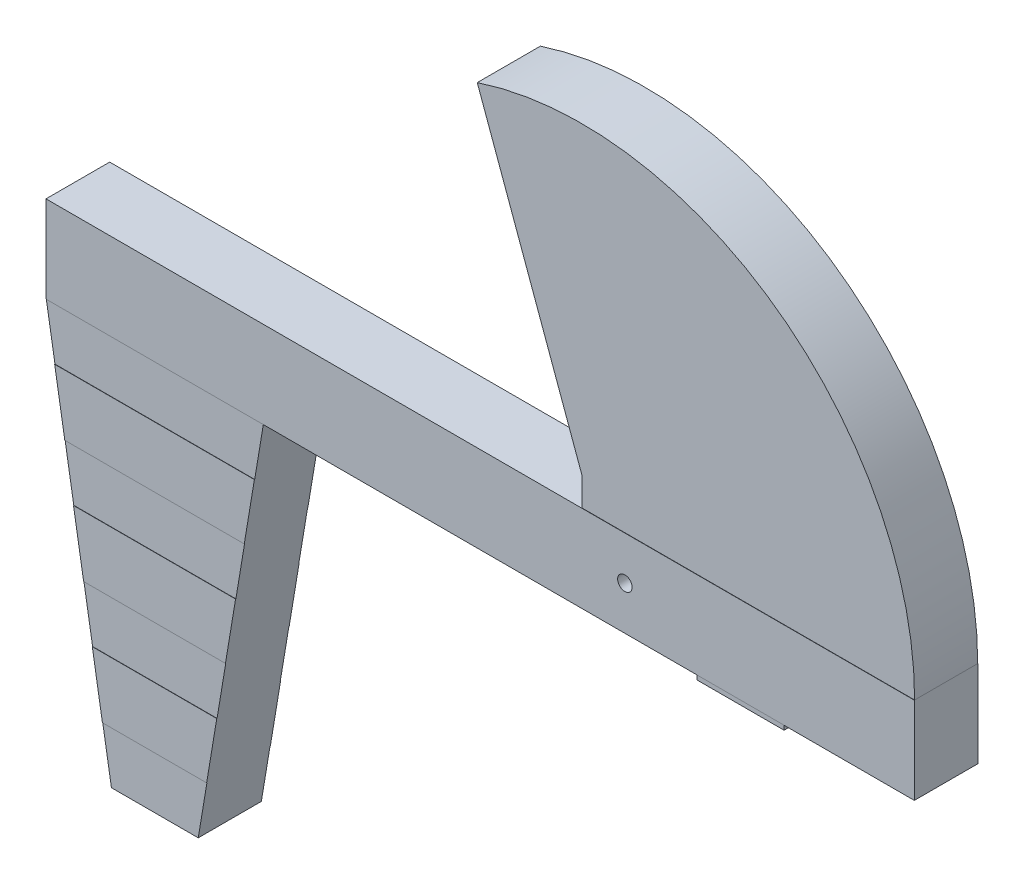
from build123d import *

# Parameters (mm, degrees)
ESQUISSE1_R             = 2.5
BOSS_EXTRU_1_DEPTH      = 11
ESQUISSE2_W             = 151.100979474
ESQUISSE2_H             = 151.100979474
ESQUISSE2_W_2           = 75
ESQUISSE2_H_2           = 18
ENL_V_MAT_EXTRU_1_DEPTH = 0.1
ESQUISSE3_W             = 30
ESQUISSE3_H             = 22
BOSS_EXTRU_2_DEPTH      = 1.5


with BuildPart() as part:
    # Esquisse1 → Boss.-Extru.1 (new, symmetric)
    with BuildSketch(Plane.XY):
        with BuildLine():
            Line((-125, -15), (100, -15))
            Line((100, -15), (100, 15))
            ThreePointArc((100, 15), (52.354982594, 108.211084747), (-51.100979474, 124.186625926))
            Line((-51.100979474, 124.186625926), (-15, 25))
            Line((-15, 25), (-15, 15))
            Line((-15, 15), (-200, 15))
            Line((-200, 15), (-200, -15))
            Line((-200, -15), (-177.5, -150))
            Line((-177.5, -150), (-147.5, -150))
            Line((-147.5, -150), (-125, -15))
        make_face()
        Circle(ESQUISSE1_R, mode=Mode.SUBTRACT)
    extrude(amount=BOSS_EXTRU_1_DEPTH, both=True)

    # Esquisse2 → Enlèv. mat.-Extru.1 (cut)
    with BuildSketch(Plane.XY.offset(11)):
        with Locations((24.449510263, 90.550489737)):
            Rectangle(ESQUISSE2_W, ESQUISSE2_H)
        with Locations((-162.5, -24)):
            Rectangle(ESQUISSE2_W_2, ESQUISSE2_H_2)
        with Locations((-162.5, -63)):
            Rectangle(ESQUISSE2_W_2, ESQUISSE2_H_2)
        with Locations((-162.5, -102)):
            Rectangle(ESQUISSE2_W_2, ESQUISSE2_H_2)
        with Locations((-162.5, -141)):
            Rectangle(ESQUISSE2_W_2, ESQUISSE2_H_2)
    enl_v_mat_extru_1 = extrude(amount=-ENL_V_MAT_EXTRU_1_DEPTH, mode=Mode.SUBTRACT)

    # Symétrie1: Enlèv. mat.-Extru.1 across plane
    add(enl_v_mat_extru_1.mirror(Plane.XY), mode=Mode.SUBTRACT)


with BuildPart() as body_2:
    # Esquisse3 → Boss.-Extru.2 (new body)
    with BuildSketch(Plane.XZ.offset(15)):
        with Locations((40, 0)):
            Rectangle(ESQUISSE3_W, ESQUISSE3_H)
    extrude(amount=BOSS_EXTRU_2_DEPTH)


solid = Compound([part.part, body_2.part])
